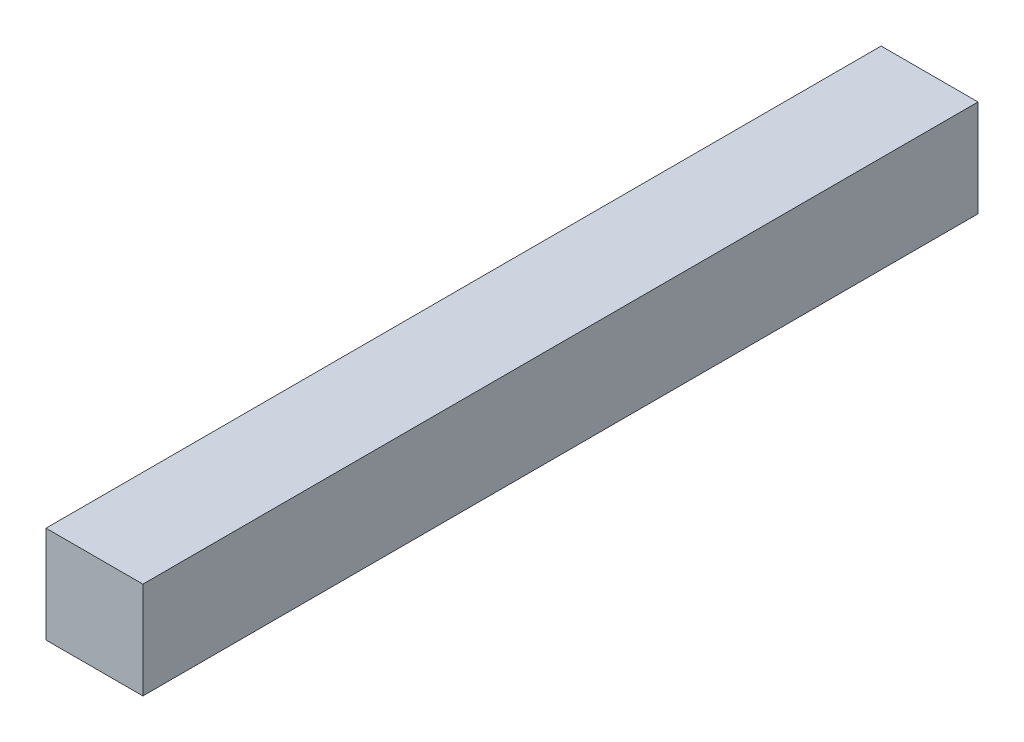
from build123d import *

# Parameters (mm, degrees)
SKETCH1_W           = 7.25
SKETCH1_H           = 7.25
BOSS_EXTRUDE1_DEPTH = 62.5


with BuildPart() as part:
    # Sketch1 → Boss-Extrude1 (new body)
    with BuildSketch(Plane.XY):
        Rectangle(SKETCH1_W, SKETCH1_H)
    extrude(amount=BOSS_EXTRUDE1_DEPTH)


solid = part.part
